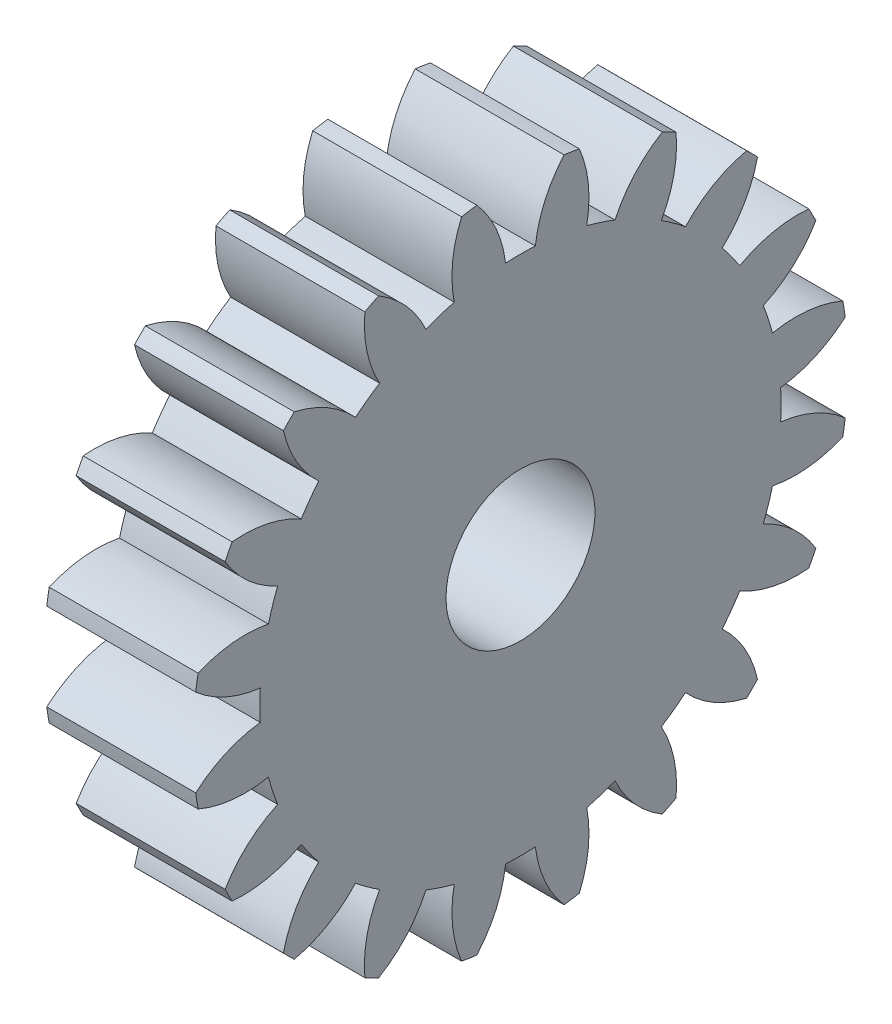
from build123d import *

# Parameters (mm, degrees)
BASPROSKE_W     = 5
BASPROSKE_H     = 11
TOOTHCUT_DEPTH  = 17.340134638
TEETHCUTS_COUNT = 20
TEETHCUTS_ANGLE = 342
BORSKE_R        = 2.5
BORE_DEPTH      = 50.0000508


with BuildPart() as part:
    # BasProSke → Base-Revolve (revolve)
    with BuildSketch(Plane(origin=(0, 0, 0), x_dir=(1, 0, 0), z_dir=(0, 1, 0)), mode=Mode.PRIVATE) as base_revolve_sk:
        with Locations((2.5, 5.5)):
            Rectangle(BASPROSKE_W, BASPROSKE_H)
    revolve(base_revolve_sk.sketch.rotate(Axis((-10, 0, 0), (1, 0, 0)), 180), axis=Axis((-10, 0, 0), (1, 0, 0)))

    # TooCutSke → ToothCut (cut, through all)
    with BuildSketch(Plane(origin=(0, 0, 0), x_dir=(0, 0, -1), z_dir=(1, 0, 0))):
        with BuildLine():
            ThreePointArc((0.499924007, 8.734705318), (0, 8.749), (-0.499924007, 8.734705318))
            ThreePointArc((-0.499924007, 8.734705318), (-0.824302243, 9.905497836), (-1.485192705, 10.924909509))
            ThreePointArc((-1.485192705, 10.924909509), (0, 11.0254), (1.485192705, 10.924909509))
            ThreePointArc((1.485192705, 10.924909509), (0.824302243, 9.905497836), (0.499924007, 8.734705318))
        make_face()
    toothcut = extrude(amount=TOOTHCUT_DEPTH, mode=Mode.SUBTRACT)

    # TeethCuts: ToothCut ×20 about axis
    teethcuts_axis = Axis((-10, 0, 0), (1, 0, 0))
    for i in range(1, TEETHCUTS_COUNT):
        add(toothcut.rotate(teethcuts_axis, i * TEETHCUTS_ANGLE / (TEETHCUTS_COUNT - 1)), mode=Mode.SUBTRACT)

    # BorSke → Bore (cut, symmetric)
    with BuildSketch(Plane(origin=(0, 0, 0), x_dir=(0, 0, -1), z_dir=(1, 0, 0))):
        with Locations(Location((0, 0, 0), (0, 0, 180))):
            Circle(BORSKE_R)
    extrude(amount=BORE_DEPTH, both=True, mode=Mode.SUBTRACT)


solid = part.part
